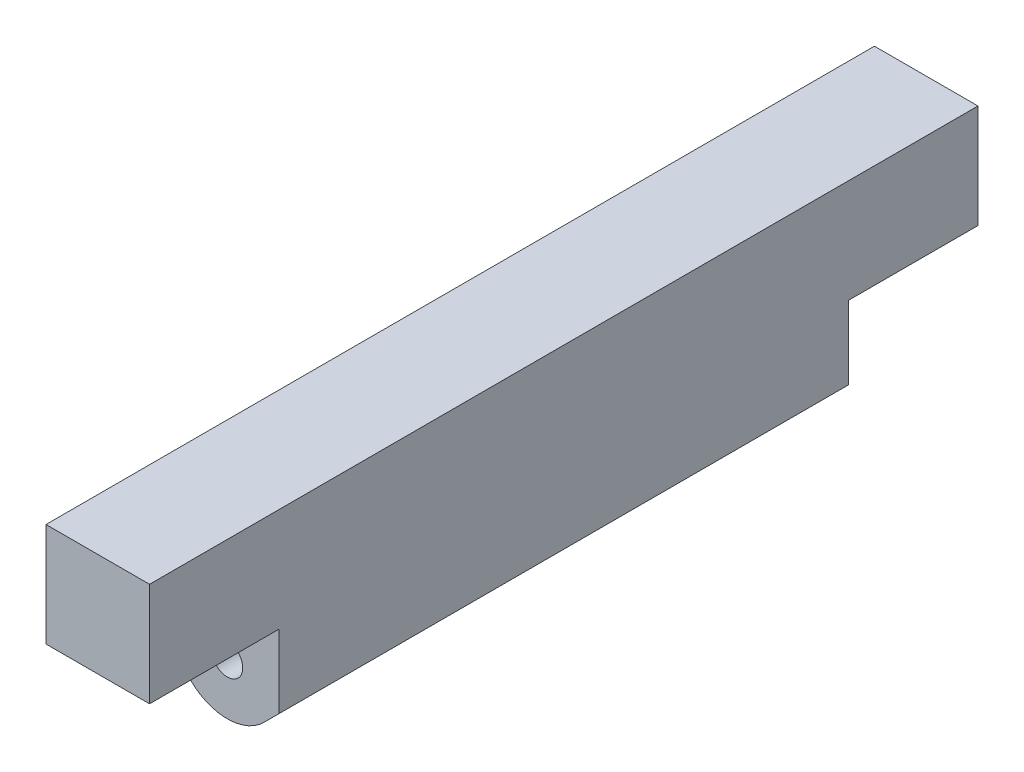
from build123d import *

# Parameters (mm, degrees)
SKETCH_1_W          = 5
SKETCH_1_H          = 10
EXTRUDE_1_DEPTH     = 27.5
SKETCH_2_W          = 5
SKETCH_2_H          = 5
EXTRUDE_2_DEPTH     = 20
SKETCH_3_R          = 0.75
CUT_EXTRUDE_1_DEPTH = 6
CUT_EXTRUDE_2_DEPTH = 27.5


with BuildPart() as part:
    # 草图1 → 凸台-拉伸1 (new body)
    with BuildSketch(Plane.XY):
        Rectangle(SKETCH_1_W, SKETCH_1_H)
    extrude(amount=EXTRUDE_1_DEPTH)

    # 草图2 → 凸台-拉伸2 (add, symmetric)
    with BuildSketch(Plane.XY.offset(13.75)):
        with Locations((0, 2.5)):
            Rectangle(SKETCH_2_W, SKETCH_2_H)
    extrude(amount=EXTRUDE_2_DEPTH, both=True)

    # 草图3 → 切除-拉伸1 (cut)
    with BuildSketch(Plane(origin=(0, 0, 0), x_dir=(-1, 0, 0), z_dir=(0, 0, -1))):
        with Locations((0, -2.5)):
            Circle(SKETCH_3_R)
    cut_extrude_1 = extrude(amount=-CUT_EXTRUDE_1_DEPTH, mode=Mode.SUBTRACT)

    # 镜向1: 切除-拉伸1 across plane
    add(cut_extrude_1.mirror(Plane.XY.offset(13.75)), mode=Mode.SUBTRACT)

    # 草图4 → 切除-拉伸2 (cut)
    with BuildSketch(Plane(origin=(0, 0, 0), x_dir=(-1, 0, 0), z_dir=(0, 0, -1))):
        with BuildLine():
            ThreePointArc((0, -5), (-0.956708581, -4.809698831), (-1.767766953, -4.267766953))
            Line((-1.767766953, -4.267766953), (-2.5, -3.535533906))
            Line((-2.5, -3.535533906), (-2.5, -5))
            Line((-2.5, -5), (0, -5))
        make_face()
        with BuildLine():
            ThreePointArc((1.767766953, -4.267766953), (0.956708581, -4.809698831), (0, -5))
            Line((0, -5), (2.5, -5))
            Line((2.5, -5), (2.5, -3.535533906))
            Line((2.5, -3.535533906), (1.767766953, -4.267766953))
        make_face()
    extrude(amount=-CUT_EXTRUDE_2_DEPTH, mode=Mode.SUBTRACT)


solid = part.part
